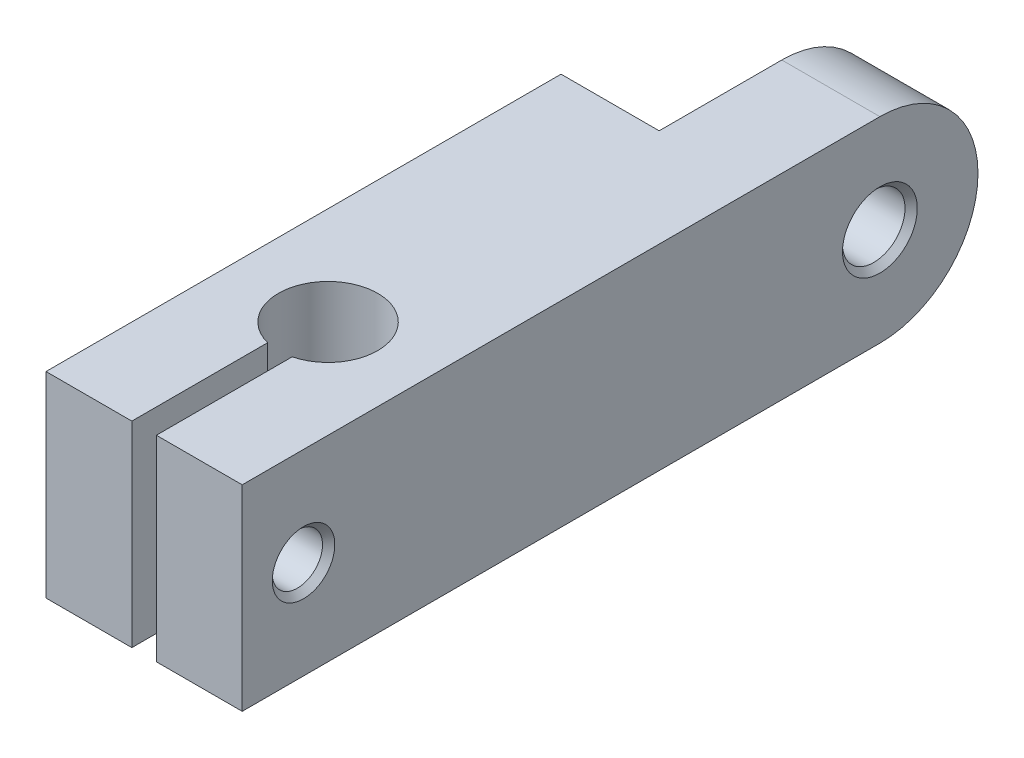
from build123d import *

# Parameters (mm, degrees)
SKETCH1_W                                   = 16
SKETCH1_H                                   = 16
BASE_DEPTH                                  = 60
SKETCH2_R                                   = 4.05
INDICATORHOLE_DEPTH                         = 63.60990337
INDICATORMOUNT_REACH                        = 64.61
SKETCH3_R                                   = 2.05
CHAMFERINDICATORMOUNT_SIZE                  = 0.5
M4X0_7_TAPPED_HOLE_FOR_INDICATORSCREW_D     = 3.3
M4X0_7_TAPPED_HOLE_FOR_INDICATORSCREW_DEPTH = 7.908579979
M4X0_7_TAPPED_HOLE_FOR_INDICATORSCREW_TIP   = 0.991420021
SKETCH6_R                                   = 8
SLOTFORANOTHERPART_DEPTH                    = 62.05735009
CHAMFERFORSLOT_DEPTH                        = 62.05735009
SKETCH7_R                                   = 2.55
SCREWHOLEFORSLOT_DEPTH                      = 63.60990337
CHAMFERFORSCREWSLOT_SIZE                    = 0.5


with BuildPart() as part:
    # Sketch1 → Base (new body)
    with BuildSketch(Plane.XY):
        Rectangle(SKETCH1_W, SKETCH1_H)
    extrude(amount=BASE_DEPTH)

    # Sketch2 → IndicatorHole (cut, through all)
    with BuildSketch(Plane(origin=(0, 8, 0), x_dir=(1, 0, 0), z_dir=(0, 1, 0))):
        with Locations((0, -45)):
            Circle(SKETCH2_R)
        with BuildLine():
            Line((-1, -48.924601891), (-1, -60))
            Line((-1, -60), (1, -60))
            Line((1, -60), (1, -48.924601891))
            ThreePointArc((1, -48.924601891), (0, -49.05), (-1, -48.924601891))
        make_face()
    extrude(amount=-INDICATORHOLE_DEPTH, mode=Mode.SUBTRACT)

    # Sketch3 → IndicatorMount (cut, up to next)
    with BuildSketch(Plane(origin=(8, 0, 0), x_dir=(0, 0, -1), z_dir=(1, 0, 0)), mode=Mode.PRIVATE) as indicatormount_sk1:
        with Locations((-55, 0)):
            Circle(SKETCH3_R)
    indicatormount_tool1 = extrude(indicatormount_sk1.sketch, amount=-INDICATORMOUNT_REACH, mode=Mode.PRIVATE) & part.part
    add(indicatormount_tool1.solids().sort_by_distance((8, 0, 55))[0], mode=Mode.SUBTRACT)

    # ChamferIndicatorMount
    chamferindicatormount_edges = [part.edges().sort_by_distance(p)[0] for p in [
        (8, 0, 57.05),
    ]]
    chamfer(chamferindicatormount_edges, length=CHAMFERINDICATORMOUNT_SIZE)

    # M4x0.7 Tapped Hole for IndicatorScrew
    with Locations(Plane.ZY.offset(8)):
        with Locations((55, 0)):
            Hole(M4X0_7_TAPPED_HOLE_FOR_INDICATORSCREW_D / 2, depth=M4X0_7_TAPPED_HOLE_FOR_INDICATORSCREW_DEPTH)
            with Locations((0, 0, -(M4X0_7_TAPPED_HOLE_FOR_INDICATORSCREW_DEPTH + M4X0_7_TAPPED_HOLE_FOR_INDICATORSCREW_TIP / 2))):  # 118° drill point
                Cone(0, M4X0_7_TAPPED_HOLE_FOR_INDICATORSCREW_D / 2, M4X0_7_TAPPED_HOLE_FOR_INDICATORSCREW_TIP, mode=Mode.SUBTRACT)

    # Sketch6 → SlotForAnotherPart (cut, through all)
    with BuildSketch(Plane(origin=(0, 0, 0), x_dir=(0, 0, -1), z_dir=(1, 0, 0))):
        with BuildLine():
            Line((-8, 8), (-18, 8))
            Line((-18, 8), (-18, -8))
            Line((-18, -8), (-8, -8))
            ThreePointArc((-8, -8), (-16, 0), (-8, 8))
        make_face()
        with Locations((-8, 0)):
            Circle(SKETCH6_R)
        with BuildLine():
            Line((1.86895154, 8), (-8, 8))
            ThreePointArc((-8, 8), (-2.343145751, 5.656854249), (0, 0))
            ThreePointArc((0, 0), (-2.343145751, -5.656854249), (-8, -8))
            Line((-8, -8), (1.86895154, -8))
            Line((1.86895154, -8), (1.86895154, 8))
        make_face()
    extrude(amount=-SLOTFORANOTHERPART_DEPTH, mode=Mode.SUBTRACT)

    # Sketch6<3> → ChamferForSlot (cut, through all)
    with BuildSketch(Plane(origin=(0, 0, 0), x_dir=(0, 0, -1), z_dir=(1, 0, 0))):
        with BuildLine():
            Line((1.86895154, 8), (-8, 8))
            ThreePointArc((-8, 8), (-2.343145751, 5.656854249), (0, 0))
            ThreePointArc((0, 0), (-2.343145751, -5.656854249), (-8, -8))
            Line((-8, -8), (1.86895154, -8))
            Line((1.86895154, -8), (1.86895154, 8))
        make_face()
    extrude(amount=CHAMFERFORSLOT_DEPTH, mode=Mode.SUBTRACT)

    # Sketch7 → ScrewHoleForSlot (cut, through all)
    with BuildSketch(Plane(origin=(8, 0, 0), x_dir=(0, 0, -1), z_dir=(1, 0, 0))):
        with Locations((-8, 0)):
            Circle(SKETCH7_R)
    extrude(amount=-SCREWHOLEFORSLOT_DEPTH, mode=Mode.SUBTRACT)

    # ChamferForScrewSlot
    chamferforscrewslot_edges = [part.edges().sort_by_distance(p)[0] for p in [
        (8, 0, 10.55),
    ]]
    chamfer(chamferforscrewslot_edges, length=CHAMFERFORSCREWSLOT_SIZE)


solid = part.part
